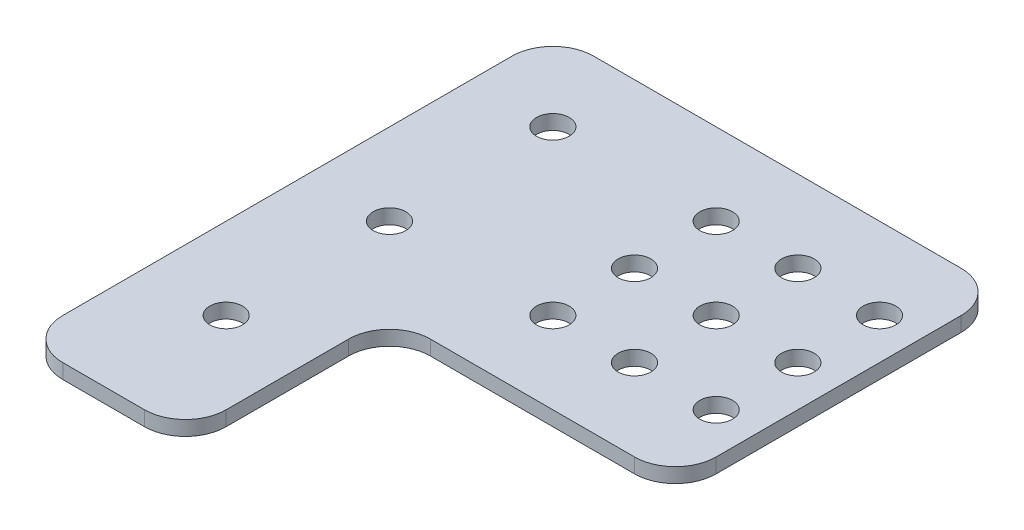
from build123d import *

# Parameters (mm, degrees)
SKETCH1_R           = 2.54
BOSS_EXTRUDE1_DEPTH = 2.286
SKETCH2_W           = 25.4
SKETCH2_H           = 31.75
CUT_EXTRUDE1_DEPTH  = 2.54
FILLET1_R           = 6.35


with BuildPart() as part:
    # Sketch1 → Boss-Extrude1 (new body)
    with BuildSketch(Plane(origin=(0, 0, 0), x_dir=(1, 0, 0), z_dir=(0, 1, 0))):
        Polygon((25.4, 114.3), (0, 114.3), (0, 0), (25.4, 0), (25.4, 31.75), (69.85, 31.75), (69.85, 82.55), (25.4, 82.55), align=None)
        with Locations(Location((12.7, 95.25, 0), (0, 0, 270))):
            Circle(SKETCH1_R, mode=Mode.SUBTRACT)
        with Locations(Location((12.7, 69.85, 0), (0, 0, 270))):
            Circle(SKETCH1_R, mode=Mode.SUBTRACT)
        with Locations(Location((12.7, 44.45, 0), (0, 0, 270))):
            Circle(SKETCH1_R, mode=Mode.SUBTRACT)
        with Locations(Location((12.7, 19.05, 0), (0, 0, 270))):
            Circle(SKETCH1_R, mode=Mode.SUBTRACT)
        with Locations(Location((38.1, 69.85, 0), (0, 0, 270))):
            Circle(SKETCH1_R, mode=Mode.SUBTRACT)
        with Locations(Location((50.8, 69.85, 0), (0, 0, 270))):
            Circle(SKETCH1_R, mode=Mode.SUBTRACT)
        with Locations(Location((63.5, 69.85, 0), (0, 0, 270))):
            Circle(SKETCH1_R, mode=Mode.SUBTRACT)
        with Locations(Location((50.8, 57.15, 0), (0, 0, 270))):
            Circle(SKETCH1_R, mode=Mode.SUBTRACT)
        with Locations(Location((63.5, 57.15, 0), (0, 0, 270))):
            Circle(SKETCH1_R, mode=Mode.SUBTRACT)
        with Locations(Location((50.8, 44.45, 0), (0, 0, 270))):
            Circle(SKETCH1_R, mode=Mode.SUBTRACT)
        with Locations(Location((63.5, 44.45, 0), (0, 0, 270))):
            Circle(SKETCH1_R, mode=Mode.SUBTRACT)
        with Locations(Location((38.1, 57.15, 0), (0, 0, 270))):
            Circle(SKETCH1_R, mode=Mode.SUBTRACT)
        with Locations(Location((38.1, 44.45, 0), (0, 0, 270))):
            Circle(SKETCH1_R, mode=Mode.SUBTRACT)
    extrude(amount=BOSS_EXTRUDE1_DEPTH)

    # Sketch2 → Cut-Extrude1 (cut)
    with BuildSketch(Plane(origin=(0, 2.286, 0), x_dir=(1, 0, 0), z_dir=(0, 1, 0))):
        with Locations((12.7, 98.425)):
            Rectangle(SKETCH2_W, SKETCH2_H)
    extrude(amount=-CUT_EXTRUDE1_DEPTH, mode=Mode.SUBTRACT)

    # Fillet1
    fillet1_edges = [part.edges().sort_by_distance(p)[0] for p in [
        (69.85, 1.143, -82.55),
        (69.85, 1.143, -31.75),
        (25.4, 1.143, -31.75),
        (25.4, 1.143, 0),
        (0, 1.143, 0),
        (0, 1.143, -82.55),
    ]]
    fillet(fillet1_edges, radius=FILLET1_R)


solid = part.part
